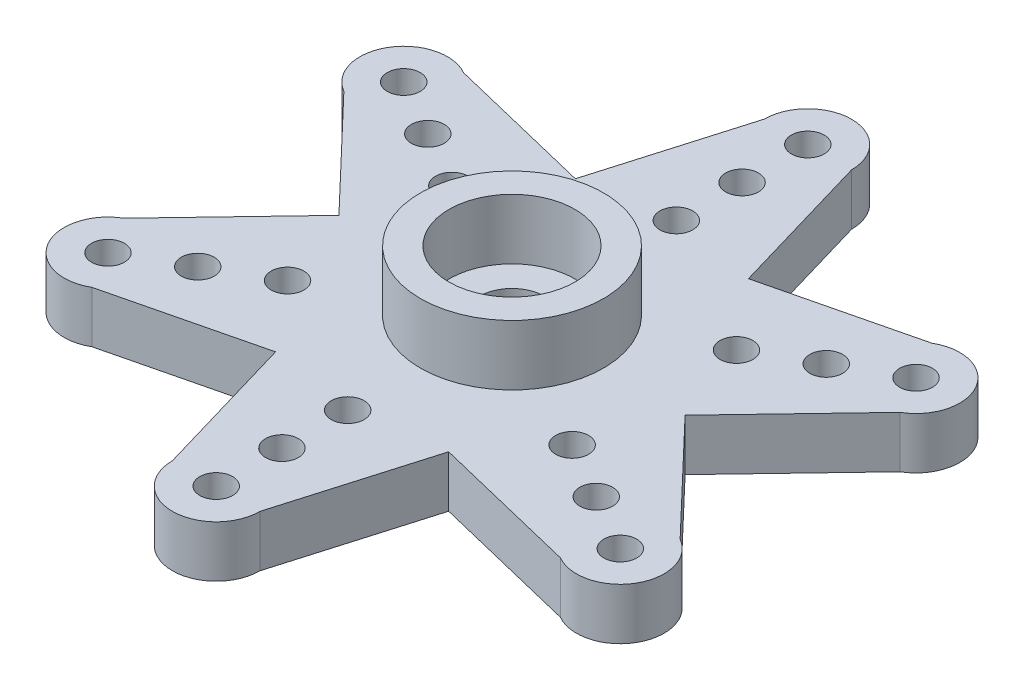
from build123d import *

# Parameters (mm, degrees)
SKETCH1_R           = 0.75
BOSS_EXTRUDE1_DEPTH = 2.35
SKETCH2_R           = 1.5
CUT_EXTRUDE1_DEPTH  = 2.35
SKETCH3_R           = 4.18
SKETCH3_R_2         = 2.875
BOSS_EXTRUDE2_DEPTH = 2.75


with BuildPart() as part:
    # Sketch1 → Boss-Extrude1 (new body)
    with BuildSketch(Plane(origin=(0, 0, 0), x_dir=(1, 0, 0), z_dir=(0, 1, 0))):
        with BuildLine():
            Line((3.95, 6.84160069), (10.691342951, 8.482050808))
            ThreePointArc((10.691342951, 8.482050808), (13.423393759, 7.75), (12.691342951, 5.017949192))
            Line((12.691342951, 5.017949192), (7.9, 0))
            Line((7.9, 0), (12.691342951, -5.017949192))
            ThreePointArc((12.691342951, -5.017949192), (13.423393759, -7.75), (10.691342951, -8.482050808))
            Line((10.691342951, -8.482050808), (3.95, -6.84160069))
            Line((3.95, -6.84160069), (2, -13.5))
            ThreePointArc((2, -13.5), (0, -15.5), (-2, -13.5))
            Line((-2, -13.5), (-3.95, -6.84160069))
            Line((-3.95, -6.84160069), (-10.691342951, -8.482050808))
            ThreePointArc((-10.691342951, -8.482050808), (-13.423393759, -7.75), (-12.691342951, -5.017949192))
            Line((-12.691342951, -5.017949192), (-7.9, 0))
            Line((-7.9, 0), (-12.691342951, 5.017949192))
            ThreePointArc((-12.691342951, 5.017949192), (-13.423393759, 7.75), (-10.691342951, 8.482050808))
            Line((-10.691342951, 8.482050808), (-3.95, 6.84160069))
            Line((-3.95, 6.84160069), (-2, 13.5))
            ThreePointArc((-2, 13.5), (0, 15.5), (2, 13.5))
            Line((2, 13.5), (3.95, 6.84160069))
        make_face()
        with Locations(Location((0, 10.5, 0), (0, 0, 270))):
            Circle(SKETCH1_R, mode=Mode.SUBTRACT)
        with Locations(Location((0, 13.5, 0), (0, 0, 270))):
            Circle(SKETCH1_R, mode=Mode.SUBTRACT)
        with Locations(Location((0, 7.5, 0), (0, 0, 270))):
            Circle(SKETCH1_R, mode=Mode.SUBTRACT)
        with Locations(Location((11.691342951, 6.75, 0), (0, 0, 270))):
            Circle(SKETCH1_R, mode=Mode.SUBTRACT)
        with Locations(Location((9.09326674, 5.25, 0), (0, 0, 270))):
            Circle(SKETCH1_R, mode=Mode.SUBTRACT)
        with Locations(Location((6.495190528, 3.75, 0), (0, 0, 270))):
            Circle(SKETCH1_R, mode=Mode.SUBTRACT)
        with Locations(Location((11.691342951, -6.75, 0), (0, 0, 270))):
            Circle(SKETCH1_R, mode=Mode.SUBTRACT)
        with Locations(Location((9.09326674, -5.25, 0), (0, 0, 270))):
            Circle(SKETCH1_R, mode=Mode.SUBTRACT)
        with Locations(Location((6.495190528, -3.75, 0), (0, 0, 270))):
            Circle(SKETCH1_R, mode=Mode.SUBTRACT)
        with Locations(Location((0, -13.5, 0), (0, 0, 270))):
            Circle(SKETCH1_R, mode=Mode.SUBTRACT)
        with Locations(Location((0, -10.5, 0), (0, 0, 270))):
            Circle(SKETCH1_R, mode=Mode.SUBTRACT)
        with Locations(Location((0, -7.5, 0), (0, 0, 270))):
            Circle(SKETCH1_R, mode=Mode.SUBTRACT)
        with Locations(Location((-11.691342951, -6.75, 0), (0, 0, 270))):
            Circle(SKETCH1_R, mode=Mode.SUBTRACT)
        with Locations(Location((-9.09326674, -5.25, 0), (0, 0, 270))):
            Circle(SKETCH1_R, mode=Mode.SUBTRACT)
        with Locations(Location((-6.495190528, -3.75, 0), (0, 0, 270))):
            Circle(SKETCH1_R, mode=Mode.SUBTRACT)
        with Locations(Location((-11.691342951, 6.75, 0), (0, 0, 270))):
            Circle(SKETCH1_R, mode=Mode.SUBTRACT)
        with Locations(Location((-9.09326674, 5.25, 0), (0, 0, 270))):
            Circle(SKETCH1_R, mode=Mode.SUBTRACT)
        with Locations(Location((-6.495190528, 3.75, 0), (0, 0, 270))):
            Circle(SKETCH1_R, mode=Mode.SUBTRACT)
    extrude(amount=BOSS_EXTRUDE1_DEPTH)

    # Sketch2 → Cut-Extrude1 (cut)
    with BuildSketch(Plane(origin=(0, 2.35, 0), x_dir=(1, 0, 0), z_dir=(0, 1, 0))):
        with Locations(Location((0, 0, 0), (0, 0, 270))):
            Circle(SKETCH2_R)
    extrude(amount=-CUT_EXTRUDE1_DEPTH, mode=Mode.SUBTRACT)

    # Sketch3 → Boss-Extrude2 (add)
    with BuildSketch(Plane(origin=(0, 2.35, 0), x_dir=(1, 0, 0), z_dir=(0, 1, 0))):
        with Locations(Location((0, 0, 0), (0, 0, 270))):
            Circle(SKETCH3_R)
        with Locations(Location((0, 0, 0), (0, 0, 270))):
            Circle(SKETCH3_R_2, mode=Mode.SUBTRACT)
    extrude(amount=BOSS_EXTRUDE2_DEPTH)


solid = part.part
